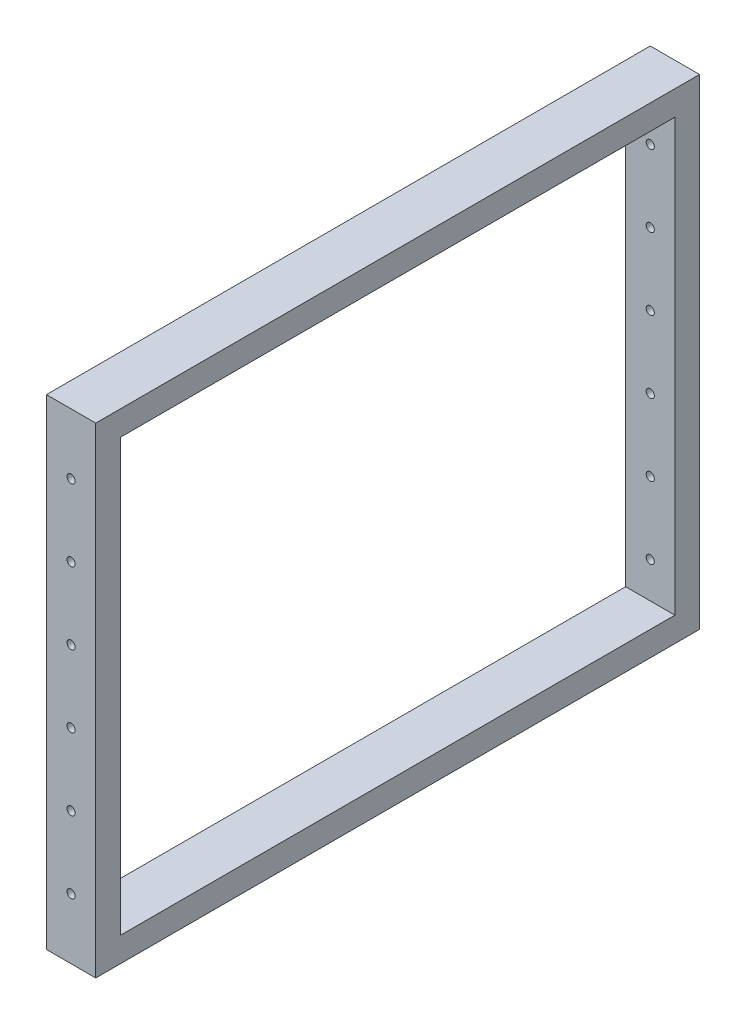
from build123d import *

# Parameters (mm, degrees)
SKETCH1_W     = 490
SKETCH1_H     = 390
FRAME_DEPTH   = 40
OPENING_START = -1
SKETCH2_W     = 450
SKETCH2_H     = 350
OPENING_DEPTH = 42
PIVOT_0_START = -1
SKETCH3_R     = 3.3
PIVOT_0_DEPTH = 492
PIVOT_1_START = -1
SKETCH4_R     = 3.3
PIVOT_1_DEPTH = 492
PIVOT_2_START = -1
SKETCH5_R     = 3.3
PIVOT_2_DEPTH = 492
PIVOT_3_START = -1
SKETCH6_R     = 3.3
PIVOT_3_DEPTH = 492
PIVOT_4_START = -1
SKETCH7_R     = 3.3
PIVOT_4_DEPTH = 492
PIVOT_5_START = -1
SKETCH8_R     = 3.3
PIVOT_5_DEPTH = 492


with BuildPart() as part:
    # Sketch1 → frame (new body)
    with BuildSketch(Plane(origin=(0, 0, 0), x_dir=(0, 0, -1), z_dir=(1, 0, 0))):
        with Locations((-245, 195)):
            Rectangle(SKETCH1_W, SKETCH1_H)
    extrude(amount=FRAME_DEPTH)


with BuildPart() as body_2:
    # Sketch2 → opening (new body)
    with BuildSketch(Plane(origin=(0, 0, 0), x_dir=(0, 0, -1), z_dir=(1, 0, 0)).offset(OPENING_START)):
        with Locations((-245, 195)):
            Rectangle(SKETCH2_W, SKETCH2_H)
    extrude(amount=OPENING_DEPTH)


with BuildPart() as part_1:
    add(part.part)

    # Combine1: cut body 2
    add(body_2.part, mode=Mode.SUBTRACT)


with BuildPart() as body_2_2:
    # Sketch3 → pivot_0 (new body)
    with BuildSketch(Plane.XY.offset(PIVOT_0_START)):
        with Locations((20, 49.166666667)):
            Circle(SKETCH3_R)
    extrude(amount=PIVOT_0_DEPTH)


with BuildPart() as part_2:
    add(part_1.part)

    # Combine2: cut body 2 2
    add(body_2_2.part, mode=Mode.SUBTRACT)


with BuildPart() as body_2_3:
    # Sketch4 → pivot_1 (new body)
    with BuildSketch(Plane.XY.offset(PIVOT_1_START)):
        with Locations((20, 107.5)):
            Circle(SKETCH4_R)
    extrude(amount=PIVOT_1_DEPTH)


with BuildPart() as part_3:
    add(part_2.part)

    # Combine3: cut body 2 3
    add(body_2_3.part, mode=Mode.SUBTRACT)


with BuildPart() as body_2_4:
    # Sketch5 → pivot_2 (new body)
    with BuildSketch(Plane.XY.offset(PIVOT_2_START)):
        with Locations((20, 165.833333333)):
            Circle(SKETCH5_R)
    extrude(amount=PIVOT_2_DEPTH)


with BuildPart() as part_4:
    add(part_3.part)

    # Combine4: cut body 2 4
    add(body_2_4.part, mode=Mode.SUBTRACT)


with BuildPart() as body_2_5:
    # Sketch6 → pivot_3 (new body)
    with BuildSketch(Plane.XY.offset(PIVOT_3_START)):
        with Locations((20, 224.166666667)):
            Circle(SKETCH6_R)
    extrude(amount=PIVOT_3_DEPTH)


with BuildPart() as part_5:
    add(part_4.part)

    # Combine5: cut body 2 5
    add(body_2_5.part, mode=Mode.SUBTRACT)


with BuildPart() as body_2_6:
    # Sketch7 → pivot_4 (new body)
    with BuildSketch(Plane.XY.offset(PIVOT_4_START)):
        with Locations((20, 282.5)):
            Circle(SKETCH7_R)
    extrude(amount=PIVOT_4_DEPTH)


with BuildPart() as part_6:
    add(part_5.part)

    # Combine6: cut body 2 6
    add(body_2_6.part, mode=Mode.SUBTRACT)


with BuildPart() as body_2_7:
    # Sketch8 → pivot_5 (new body)
    with BuildSketch(Plane.XY.offset(PIVOT_5_START)):
        with Locations((20, 340.833333333)):
            Circle(SKETCH8_R)
    extrude(amount=PIVOT_5_DEPTH)


with BuildPart() as part_7:
    add(part_6.part)

    # Combine7: cut body 2 7
    add(body_2_7.part, mode=Mode.SUBTRACT)


solid = part_7.part
